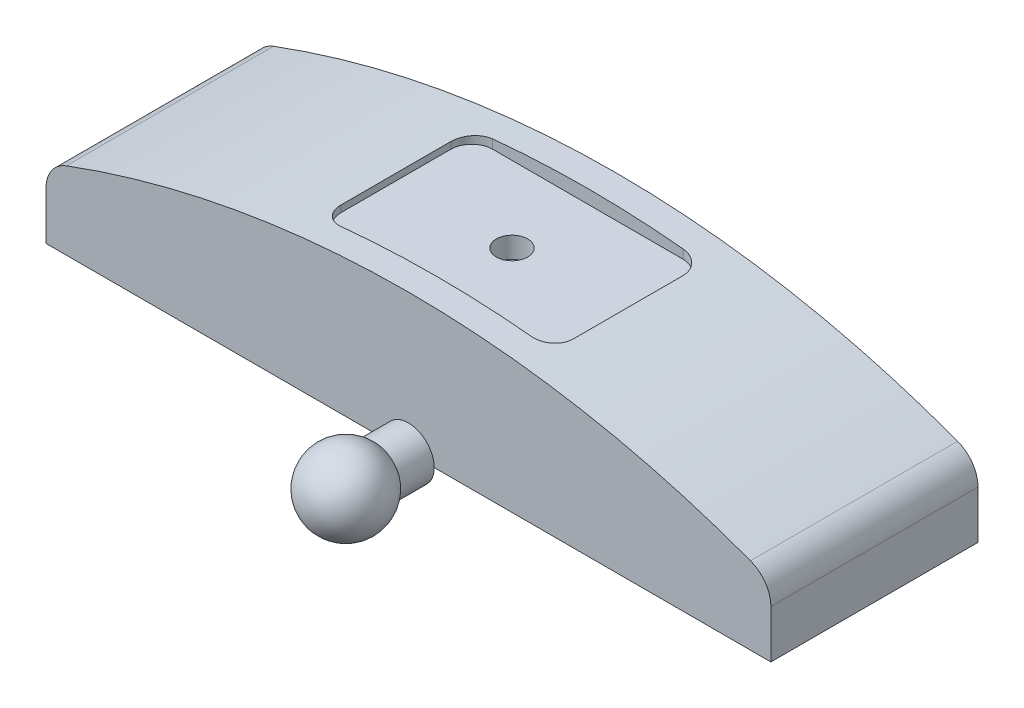
from build123d import *

# Parameters (mm, degrees)
SKETCH1_W           = 69.3
SKETCH1_H           = 19.8
BOSS_EXTRUDE1_DEPTH = 13.3
CUT_EXTRUDE1_DEPTH  = 48.412254857
CUT_EXTRUDE2_DEPTH  = 3
SKETCH5_R           = 1.5
CUT_EXTRUDE3_DEPTH  = 2
FILLET1_R           = 3


with BuildPart() as part:
    # Sketch1 → Boss-Extrude1 (new body)
    with BuildSketch(Plane(origin=(0, 0, 0), x_dir=(1, 0, 0), z_dir=(0, 1, 0))):
        Rectangle(SKETCH1_W, SKETCH1_H)
    extrude(amount=BOSS_EXTRUDE1_DEPTH)

    # Sketch2 → Revolve1 (revolve)
    with BuildSketch(Plane(origin=(0, 0, 0), x_dir=(1, 0, 0), z_dir=(0, 1, 0))):
        with BuildLine():
            Line((2.465, -9.9), (2.465, -13.12))
            ThreePointArc((2.465, -13.12), (3.467767545, -17.211295036), (0, -19.602701751))
            Line((0, -19.602701751), (0, -9.9))
            Line((0, -9.9), (2.465, -9.9))
        make_face()
    revolve(axis=Axis((0, 0, 0), (0, 0, 1)))

    # Sketch3 → Cut-Extrude1 (cut, through all)
    with BuildSketch(Plane(origin=(0, 0, -9.9), x_dir=(-1, 0, 0), z_dir=(0, 0, -1))):
        with BuildLine():
            Line((-34.65, 13.3), (-34.65, 6.65))
            ThreePointArc((-34.65, 6.65), (-17.641180346, 11.622466932), (3.46e-07, 13.3))
            Line((3.46e-07, 13.3), (-34.65, 13.3))
        make_face()
        with BuildLine():
            ThreePointArc((3.46e-07, 13.3), (17.641180686, 11.622466867), (34.65, 6.65))
            Line((34.65, 6.65), (34.65, 13.3))
            Line((34.65, 13.3), (3.46e-07, 13.3))
        make_face()
    extrude(amount=-CUT_EXTRUDE1_DEPTH, mode=Mode.SUBTRACT)

    # Sketch4 → Cut-Extrude2 (cut)
    with BuildSketch(Plane(origin=(0, 15, 0), x_dir=(1, 0, 0), z_dir=(0, 1, 0))):
        with BuildLine():
            Line((-9.1, -7.25), (9.1, -7.25))
            ThreePointArc((9.1, -7.25), (10.514213562, -6.664213562), (11.1, -5.25))
            Line((11.1, -5.25), (11.1, 5.25))
            ThreePointArc((11.1, 5.25), (10.514213562, 6.664213562), (9.1, 7.25))
            Line((9.1, 7.25), (-9.1, 7.25))
            ThreePointArc((-9.1, 7.25), (-10.514213562, 6.664213562), (-11.1, 5.25))
            Line((-11.1, 5.25), (-11.1, -5.25))
            ThreePointArc((-11.1, -5.25), (-10.514213562, -6.664213562), (-9.1, -7.25))
        make_face()
    extrude(amount=-CUT_EXTRUDE2_DEPTH, mode=Mode.SUBTRACT)

    # Sketch5 → Cut-Extrude3 (cut)
    with BuildSketch(Plane(origin=(0, 12, 0), x_dir=(1, 0, 0), z_dir=(0, 1, 0))):
        with Locations(Location((0, 0, 0), (0, 0, 270))):
            Circle(SKETCH5_R)
    extrude(amount=-CUT_EXTRUDE3_DEPTH, mode=Mode.SUBTRACT)

    # Fillet1
    fillet1_edges = [part.edges().sort_by_distance(p)[0] for p in [
        (34.65, 6.65, 0),
        (-34.65, 6.65, 0),
    ]]
    fillet(fillet1_edges, radius=FILLET1_R)


solid = part.part
